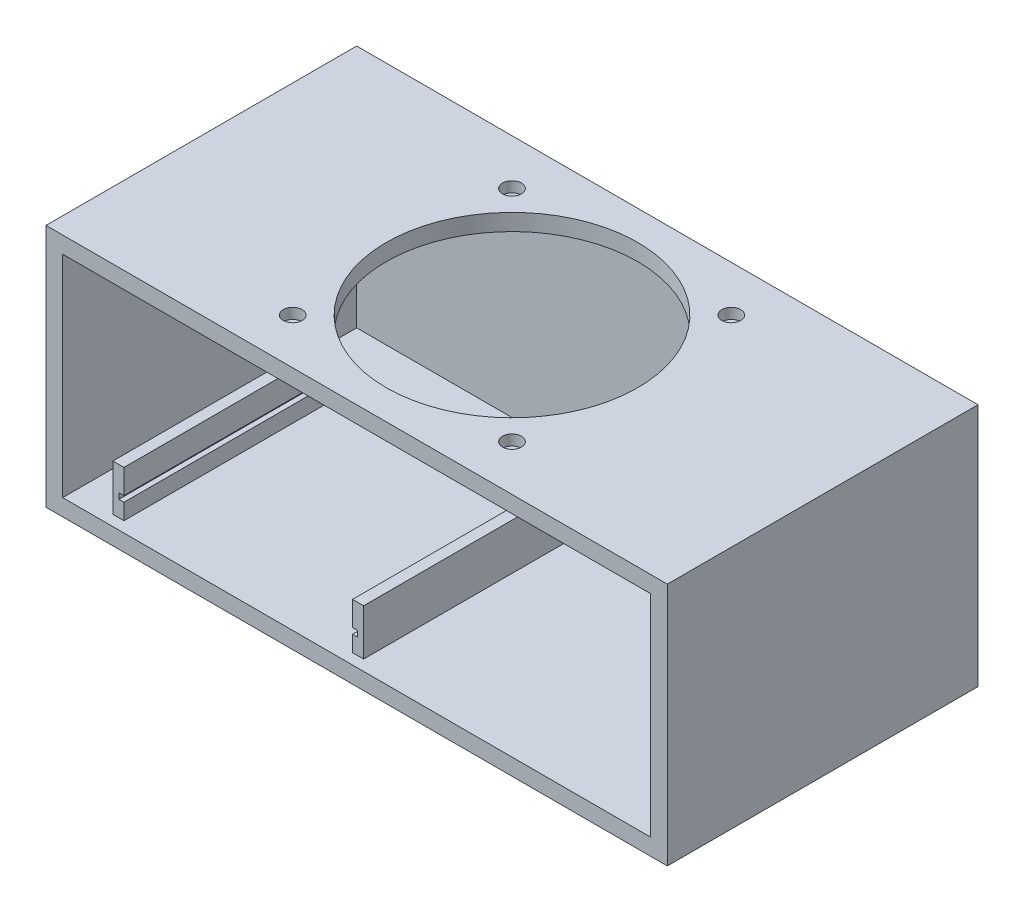
from build123d import *

# Parameters (mm, degrees)
SKETCH1_W           = 177.8
SKETCH1_H           = 88.9
BOSS_EXTRUDE1_DEPTH = 69.85
SHELL1_T            = -4.7625
SKETCH3_R           = 36
CUT_EXTRUDE1_DEPTH  = 57.912
SKETCH4_R           = 2.7
CUT_EXTRUDE4_DEPTH  = 3
SKETCH5_W           = 3.175
SKETCH5_H           = 58.95074776
BOSS_EXTRUDE4_DEPTH = 13.208
SKETCH8_W           = 1.447073232
SKETCH8_H           = 1.651
CUT_EXTRUDE8_DEPTH  = 56.134


with BuildPart() as part:
    # Sketch1 → Boss-Extrude1 (new body)
    with BuildSketch(Plane(origin=(0, 0, 0), x_dir=(1, 0, 0), z_dir=(0, 1, 0))):
        Rectangle(SKETCH1_W, SKETCH1_H)
    extrude(amount=BOSS_EXTRUDE1_DEPTH)

    # Shell1
    shell1_openings = [part.faces().sort_by_distance(p)[0] for p in [
        (0, 34.925, 44.45),
    ]]
    offset(amount=SHELL1_T, openings=shell1_openings, kind=Kind.INTERSECTION)

    # Sketch3 → Cut-Extrude1 (cut)
    with BuildSketch(Plane(origin=(0, 69.85, 0), x_dir=(1, 0, 0), z_dir=(0, 1, 0))):
        with Locations(Location((0, 0, 0), (0, 0, 270))):
            Circle(SKETCH3_R)
    extrude(amount=-CUT_EXTRUDE1_DEPTH, mode=Mode.SUBTRACT)

    # Sketch4 → Cut-Extrude4 (cut)
    with BuildSketch(Plane(origin=(0, 69.85, 0), x_dir=(1, 0, 0), z_dir=(0, 1, 0))):
        with Locations(Location((-31.373598792, 31.373598792, 0), (0, 0, 270))):
            Circle(SKETCH4_R)
        with Locations(Location((31.373598792, 31.373598792, 0), (0, 0, 90))):
            Circle(SKETCH4_R)
        with Locations(Location((31.373598792, -31.373598792, 0), (0, 0, 270))):
            Circle(SKETCH4_R)
        with Locations(Location((-31.373598792, -31.373598792, 0), (0, 0, 90))):
            Circle(SKETCH4_R)
    extrude(amount=-CUT_EXTRUDE4_DEPTH, mode=Mode.SUBTRACT)

    # Sketch5 → Boss-Extrude4 (add)
    with BuildSketch(Plane(origin=(0, 4.7625, 0), x_dir=(1, 0, 0), z_dir=(0, 1, 0))):
        with Locations((-2.654293776, -11.925687975)):
            Rectangle(SKETCH5_W, SKETCH5_H)
        Polygon((-69.646793776, -41.401061855), (-69.646793776, 17.549685905), (-72.821793776, 17.549685905), (-72.821793776, 0), (-72.821793776, -41.401061855), align=None)
    extrude(amount=BOSS_EXTRUDE4_DEPTH)

    # Sketch8 → Cut-Extrude8 (cut)
    with BuildSketch(Plane.XY.offset(41.401061855)):
        with Locations((-70.370330392, 10.16)):
            Rectangle(SKETCH8_W, SKETCH8_H)
        with Locations((-3.51825716, 10.16)):
            Rectangle(SKETCH8_W, SKETCH8_H)
    extrude(amount=-CUT_EXTRUDE8_DEPTH, mode=Mode.SUBTRACT)


solid = part.part
